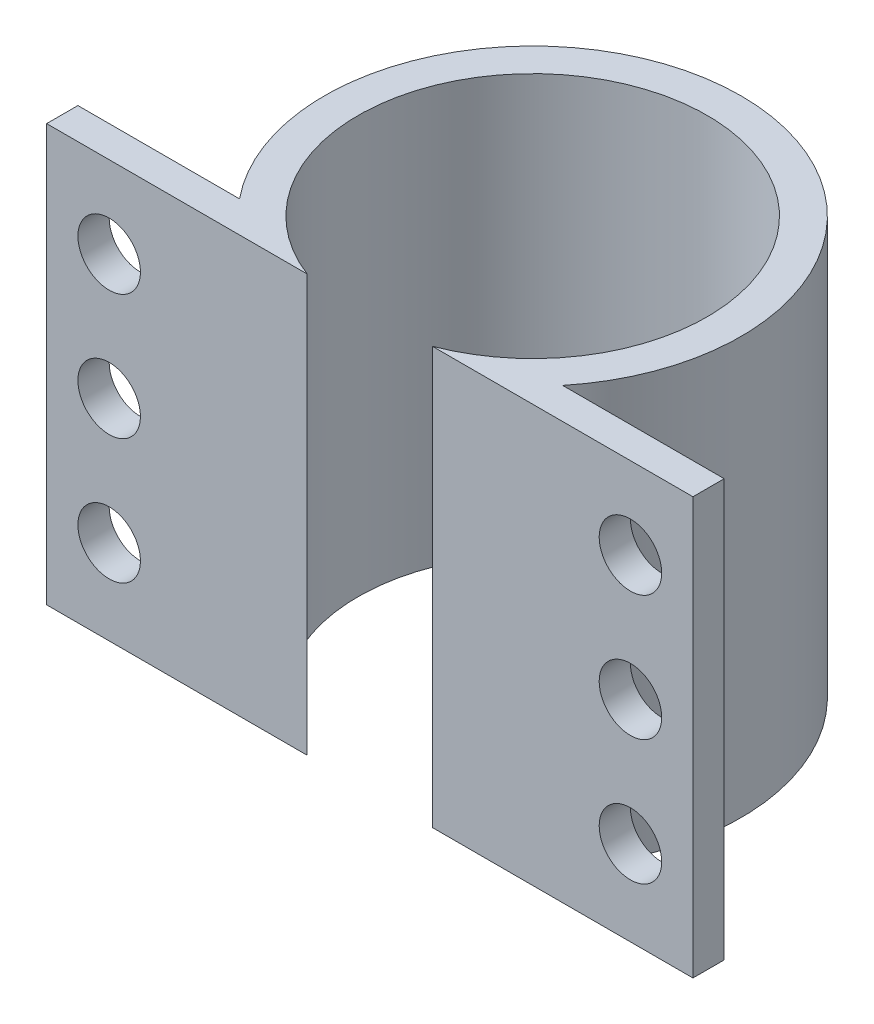
from build123d import *

# Parameters (mm, degrees)
SALIENTE_EXTRUIR1_DEPTH = 40
CROQUIS2_R              = 3
CORTAR_EXTRUIR1_DEPTH   = 10


with BuildPart() as part:
    # Croquis1 → Saliente-Extruir1 (new body)
    with BuildSketch(Plane(origin=(0, 0, 0), x_dir=(1, 0, 0), z_dir=(0, 1, 0))):
        with BuildLine():
            Line((6.013434035, -15.633333333), (31.013434035, -15.633333333))
            Line((31.013434035, -15.633333333), (31.013434035, -12.633333333))
            Line((31.013434035, -12.633333333), (15.504802123, -12.633333333))
            ThreePointArc((15.504802123, -12.633333333), (0, 20), (-15.504802123, -12.633333333))
            Line((-15.504802123, -12.633333333), (-31.013434035, -12.633333333))
            Line((-31.013434035, -12.633333333), (-31.013434035, -15.633333333))
            Line((-31.013434035, -15.633333333), (-6.013434035, -15.633333333))
            ThreePointArc((-6.013434035, -15.633333333), (0, 16.75), (6.013434035, -15.633333333))
        make_face()
    extrude(amount=SALIENTE_EXTRUIR1_DEPTH)

    # Croquis2 → Cortar-Extruir1 (cut)
    with BuildSketch(Plane(origin=(0, 0, 12.633333333), x_dir=(-1, 0, 0), z_dir=(0, 0, -1))):
        with Locations((25.013434035, 8.154431535)):
            Circle(CROQUIS2_R)
        with Locations((25.013434035, 20.154431535)):
            Circle(CROQUIS2_R)
        with Locations((25.013434035, 32.154431535)):
            Circle(CROQUIS2_R)
        with Locations((-25.013434035, 32.154431535)):
            Circle(CROQUIS2_R)
        with Locations((-25.013434035, 8.154431535)):
            Circle(CROQUIS2_R)
        with Locations((-25.013434035, 20.154431535)):
            Circle(CROQUIS2_R)
    extrude(amount=-CORTAR_EXTRUIR1_DEPTH, mode=Mode.SUBTRACT)


solid = part.part
